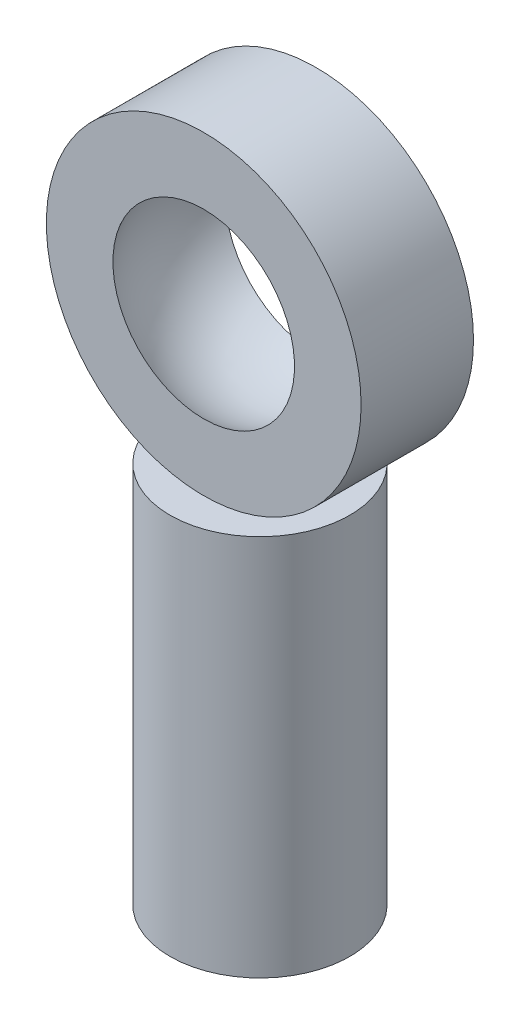
from build123d import *

# Parameters (mm, degrees)
EXTRUDE_1_DEPTH       = 2.5
EXTRUDE_1_DEPTH_BACK  = 2.5
SKETCH_1_R            = 7
SKETCH_4_R            = 4
EXTRUDE_480_DEPTH     = 17
SKETCH_5_R            = 2
CUT_EXTRUDE_557_DEPTH = 12


with BuildPart() as part:
    # Эскиз1 → Бобышка-Вытянуть1 (new, two sides: drawn at the far end of the back side and taken through both)
    with BuildSketch(Plane.XY.offset(-EXTRUDE_1_DEPTH_BACK)):
        Circle(SKETCH_1_R)
    extrude(amount=EXTRUDE_1_DEPTH + EXTRUDE_1_DEPTH_BACK)

    # Эскиз8 → Cut-Revolve 690 (revolve, cut)
    with BuildSketch(Plane(origin=(0, 0, 0), x_dir=(0, 0, -1), z_dir=(1, 0, 0))):
        with BuildLine():
            Line((-3.5, 0), (3.5, 0))
            Line((3.5, 0), (3.5, 3.211308145))
            ThreePointArc((3.5, 3.211308145), (0, 4.75), (-3.5, 3.211308145))
            Line((-3.5, 3.211308145), (-3.5, 0))
        make_face()
    revolve(axis=Axis((0, 0, 3.5), (0, 0, -1)), mode=Mode.SUBTRACT)


with BuildPart() as body_2:
    # Эскиз4 → Extrude 480 (new body)
    with BuildSketch(Plane(origin=(0, -7, 0), x_dir=(1, 0, 0), z_dir=(0, 1, 0))):
        Circle(SKETCH_4_R)
    extrude(amount=-EXTRUDE_480_DEPTH)

    # Эскиз5 → Cut-Extrude 557 (cut)
    with BuildSketch(Plane.XZ.offset(24)):
        Circle(SKETCH_5_R)
    extrude(amount=-CUT_EXTRUDE_557_DEPTH, mode=Mode.SUBTRACT)


solid = Compound([part.part, body_2.part])
